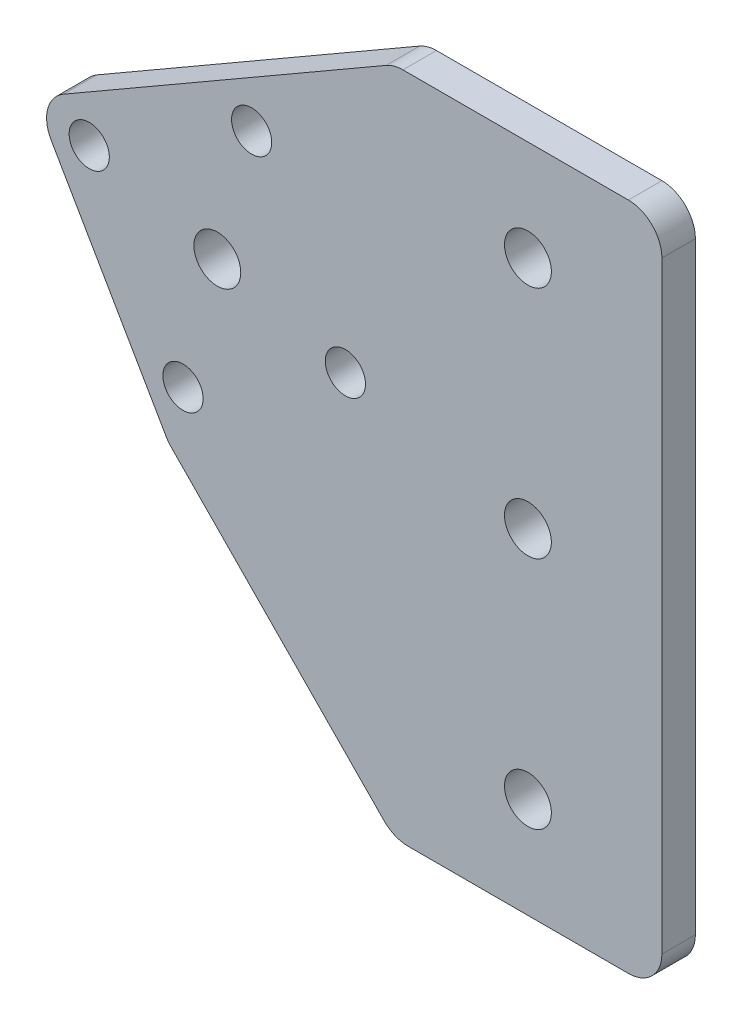
from build123d import *

# Parameters (mm, degrees)
BOSS_EXTRU_1_DEPTH           = 5
ENL_V_MAT_EXTRU_1_DEPTH      = 138.125803563
ENL_V_MAT_EXTRU_1_DEPTH_BACK = 138.125803563
ESQUISSE2_R                  = 3.5
ESQUISSE2_R_2                = 3
CONG_1_R                     = 5


with BuildPart() as part:
    # Esquisse1 → Boss.-Extru.1 (new body)
    with BuildSketch(Plane.XY):
        Polygon((0, 0), (0, 100), (-40, 100), (-93.693575035, 69), (-73.693575035, 34.358983849), (-40, 0), align=None)
    extrude(amount=BOSS_EXTRU_1_DEPTH)

    # Esquisse2 → Enlèv. mat.-Extru.1 (cut, two sides: drawn at the far end of the back side and taken through both)
    with BuildSketch(Plane.XY.offset(5).offset(-ENL_V_MAT_EXTRU_1_DEPTH_BACK)):
        with Locations((-20, 15)):
            Circle(ESQUISSE2_R)
        with Locations((-20, 50)):
            Circle(ESQUISSE2_R)
        with Locations((-20, 85)):
            Circle(ESQUISSE2_R)
        with Locations((-66.373066959, 61.679491924)):
            Circle(ESQUISSE2_R)
        with Locations((-85.497422612, 66.803847577)):
            Circle(ESQUISSE2_R_2)
        with Locations((-61.248711306, 80.803847577)):
            Circle(ESQUISSE2_R_2)
        with Locations((-47.248711306, 56.555136271)):
            Circle(ESQUISSE2_R_2)
        with Locations((-71.497422612, 42.555136271)):
            Circle(ESQUISSE2_R_2)
    extrude(amount=ENL_V_MAT_EXTRU_1_DEPTH + ENL_V_MAT_EXTRU_1_DEPTH_BACK, mode=Mode.SUBTRACT)

    # Congé1
    cong_1_edges = [part.edges().sort_by_distance(p)[0] for p in [
        (-40, 0, 2.5),
        (-73.693575035, 34.358983849, 2.5),
        (-93.693575035, 69, 2.5),
        (-40, 100, 2.5),
        (0, 100, 2.5),
        (0, 0, 2.5),
    ]]
    fillet(cong_1_edges, radius=CONG_1_R)


solid = part.part
